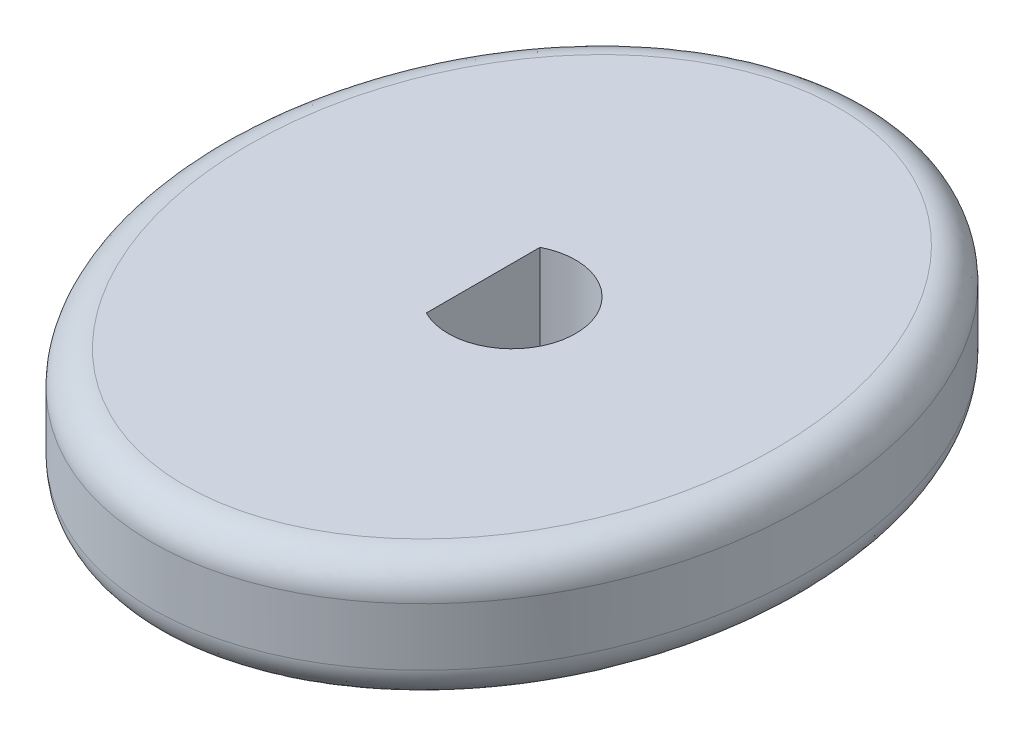
from build123d import *

# Parameters (mm, degrees)
BOSS_EXTRUDE1_DEPTH      = 1.5
BOSS_EXTRUDE1_DEPTH_BACK = 1.5
SKETCH1_RX               = 8.75
SKETCH1_RY               = 7.2
FILLET1_R                = 0.8


with BuildPart() as part:
    # Sketch1 → Boss-Extrude1 (new, two sides: drawn at the far end of the back side and taken through both)
    with BuildSketch(Plane(origin=(0, 0, 0), x_dir=(1, 0, 0), z_dir=(0, 1, 0)).offset(-BOSS_EXTRUDE1_DEPTH_BACK)):
        with Locations(Location((0, 0), (0, 0, 90))):
            Ellipse(SKETCH1_RX, SKETCH1_RY)
        with BuildLine():
            Line((-0.7, 1.382931669), (-0.7, -1.382931669))
            ThreePointArc((-0.7, -1.382931669), (1.55, 0), (-0.7, 1.382931669))
        make_face(mode=Mode.SUBTRACT)
    extrude(amount=BOSS_EXTRUDE1_DEPTH + BOSS_EXTRUDE1_DEPTH_BACK)

    # Fillet1
    fillet1_edges = [part.edges().sort_by_distance(p)[0] for p in [
        (0.000739081, -1.5, 8.749999954),
        (0.000739081, 1.5, 8.749999954),
    ]]
    fillet(fillet1_edges, radius=FILLET1_R)


solid = part.part
